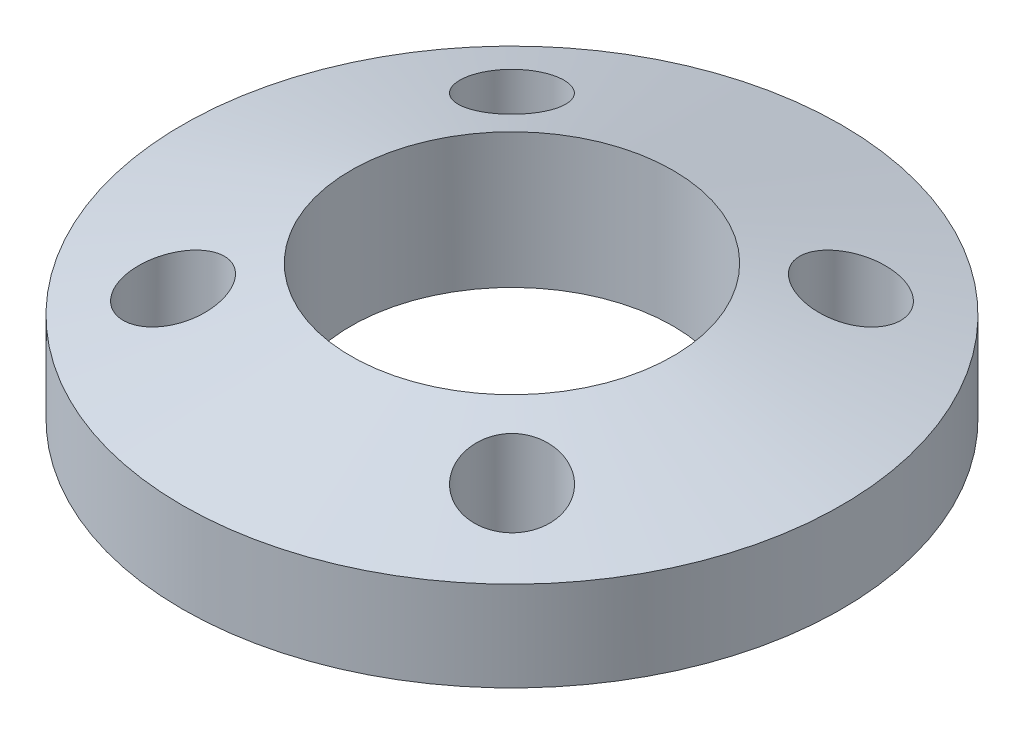
from build123d import *

# Parameters (mm, degrees)
SKETCH1_R           = 11
SKETCH1_R_2         = 5.375
SKETCH1_R_3         = 1.475
BOSS_EXTRUDE1_DEPTH = 3
SKETCH6_R           = 1.475
CUT_EXTRUDE1_DEPTH  = 11


with BuildPart() as part:
    # Sketch1 → Boss-Extrude1 (new body)
    with BuildSketch(Plane(origin=(0, 0, 0), x_dir=(1, 0, 0), z_dir=(0, 1, 0))):
        with Locations(Location((0, 0, 0), (0, 0, 270))):
            Circle(SKETCH1_R)
        with Locations(Location((0, 0, 0), (0, 0, 270))):
            Circle(SKETCH1_R_2, mode=Mode.SUBTRACT)
        with Locations(Location((-5.657708628, -5.655999742, 0), (0, 0, 270))):
            Circle(SKETCH1_R_3, mode=Mode.SUBTRACT)
        with Locations(Location((-5.657708628, 5.655999742, 0), (0, 0, 270))):
            Circle(SKETCH1_R_3, mode=Mode.SUBTRACT)
        with Locations(Location((5.657708628, 5.655999742, 0), (0, 0, 270))):
            Circle(SKETCH1_R_3, mode=Mode.SUBTRACT)
        with Locations(Location((5.657708628, -5.655999742, 0), (0, 0, 270))):
            Circle(SKETCH1_R_3, mode=Mode.SUBTRACT)
    extrude(amount=BOSS_EXTRUDE1_DEPTH)

    # Sketch5 → Revolve1 (revolve)
    with BuildSketch(Plane(origin=(0, 0, 0), x_dir=(0, 0, -1), z_dir=(1, 0, 0))):
        Polygon((5.375, 4.5), (5.375, 3), (11, 3), align=None)
    revolve(axis=Axis((0, 0, 0), (0, 1, 0)))

    # Sketch6 → Cut-Extrude1 (cut)
    with BuildSketch(Plane.XZ):
        with Locations(Location((-5.657708628, 5.655999742, 0), (0, 0, 221.262911431))):
            Circle(SKETCH6_R)
        with Locations(Location((-5.657708628, -5.655999742, 0), (0, 0, 224.999958606))):
            Circle(SKETCH6_R)
        with Locations(Location((5.657708628, 5.655999742, 0), (0, 0, 225.00013267))):
            Circle(SKETCH6_R)
        with Locations(Location((5.657708628, -5.655999742, 0), (0, 0, 228.738417152))):
            Circle(SKETCH6_R)
    extrude(amount=-CUT_EXTRUDE1_DEPTH, mode=Mode.SUBTRACT)


solid = part.part
